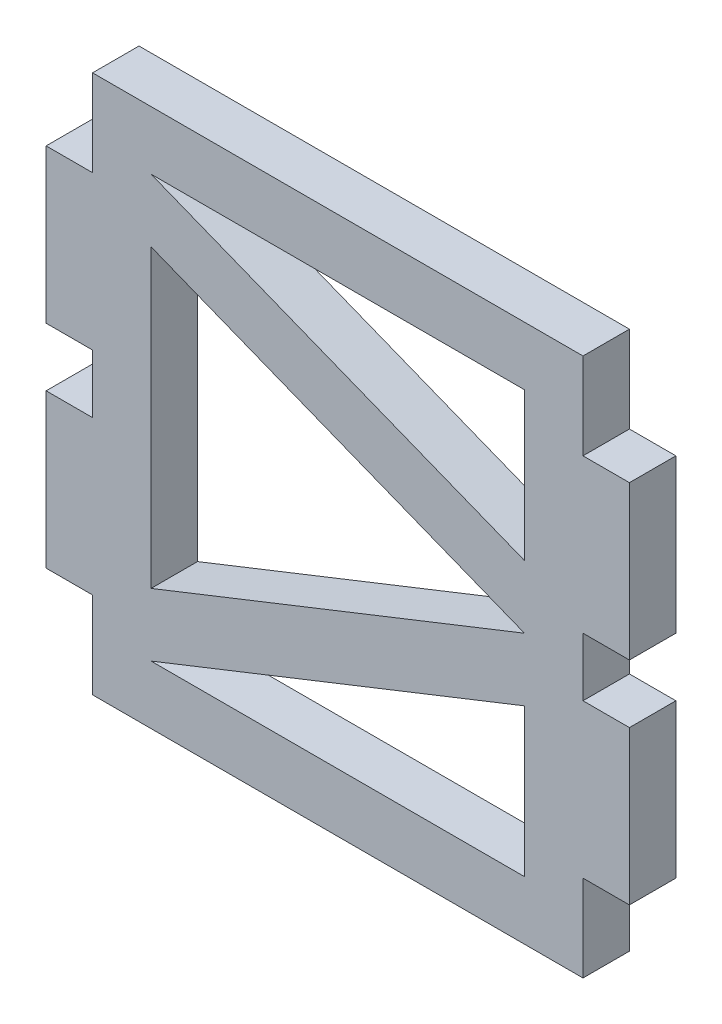
from build123d import *

# Parameters (mm, degrees)
BOSS_EXTRUDE1_DEPTH = 3.175


with BuildPart() as part:
    # Sketch1 → Boss-Extrude1 (new body)
    with BuildSketch(Plane.XY):
        Polygon((3.175, 27.5), (0, 27.5), (0, 38), (3.175, 38), (3.175, 42), (0, 42), (0, 52.5), (3.175, 52.5), (3.175, 58.4125), (36.7, 58.4125), (36.7, 52.5), (39.875, 52.5), (39.875, 42), (36.7, 42), (36.7, 38), (39.875, 38), (39.875, 27.5), (36.7, 27.5), (36.7, 21.5875), (3.175, 21.5875), align=None)
        Polygon((32.7, 40), (7.175, 50.110154656), (7.175, 29.889845344), align=None, mode=Mode.SUBTRACT)
        Polygon((32.7, 54.4125), (7.175, 54.4125), (32.7, 44.302345344), align=None, mode=Mode.SUBTRACT)
        Polygon((32.7, 25.5875), (32.7, 35.697654656), (7.175, 25.5875), align=None, mode=Mode.SUBTRACT)
    extrude(amount=BOSS_EXTRUDE1_DEPTH)


solid = part.part
